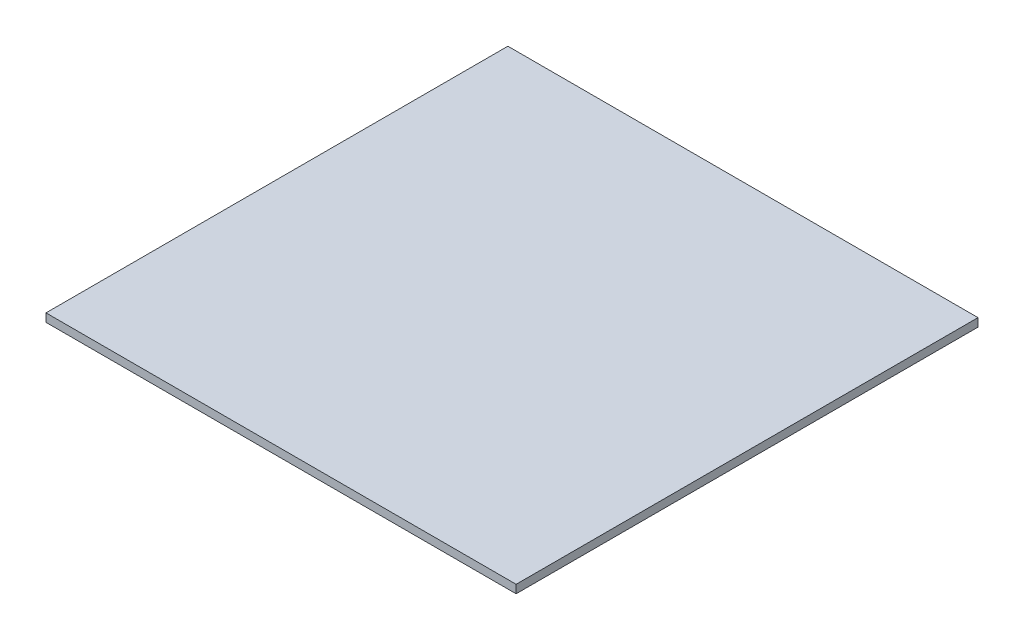
from build123d import *

# Parameters (mm, degrees)
SKETCH1_W           = 180.975
SKETCH1_H           = 177.8
BOSS_EXTRUDE1_DEPTH = 3.175


with BuildPart() as part:
    # Sketch1 → Boss-Extrude1 (new body)
    with BuildSketch(Plane(origin=(0, 0, 0), x_dir=(1, 0, 0), z_dir=(0, 1, 0))):
        Rectangle(SKETCH1_W, SKETCH1_H)
    extrude(amount=BOSS_EXTRUDE1_DEPTH)


solid = part.part
